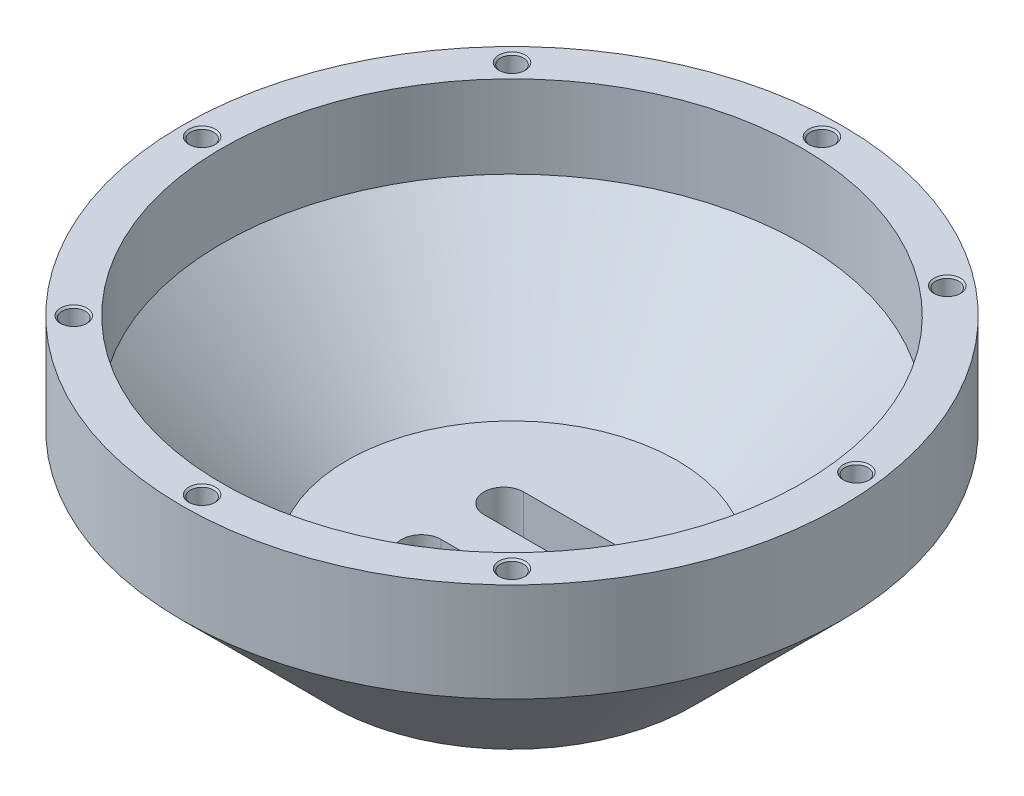
from build123d import *

# Parameters (mm, degrees)
CUT_EXTRUDE1_DEPTH              = 161.078105936
M8X1_0_TAPPED_HOLE2_D           = 7
M8X1_0_TAPPED_HOLE2_DEPTH       = 21
M8X1_0_TAPPED_HOLE2_CSINK_D     = 8.05
M8X1_0_TAPPED_HOLE2_CSINK_ANGLE = 90
M8X1_0_TAPPED_HOLE2_TIP         = 2.103012167


with BuildPart() as part:
    # Sketch2 → Revolve1 (revolve)
    with BuildSketch(Plane.XY, mode=Mode.PRIVATE) as revolve1_sk:
        Polygon((55, 0), (100, 45), (100, 75), (88, 75), (88, 49.970562748), (50.029437252, 12), (0, 12), (0, 0), align=None)
    revolve(revolve1_sk.sketch.rotate(Axis((0, 0, 0), (0, 1, 0)), 90), axis=Axis((0, 0, 0), (0, 1, 0)))

    # Sketch3 → Cut-Extrude1 (cut, through all)
    with BuildSketch(Plane.XZ):
        with BuildLine():
            Line((-15, 18.5), (15, 18.5))
            ThreePointArc((15, 18.5), (21, 12.5), (15, 6.5))
            Line((15, 6.5), (-15, 6.5))
            ThreePointArc((-15, 6.5), (-21, 12.5), (-15, 18.5))
        make_face()
        with BuildLine():
            Line((-15, -6.5), (15, -6.5))
            ThreePointArc((15, -6.5), (21, -12.5), (15, -18.5))
            Line((15, -18.5), (-15, -18.5))
            ThreePointArc((-15, -18.5), (-21, -12.5), (-15, -6.5))
        make_face()
    extrude(amount=-CUT_EXTRUDE1_DEPTH, mode=Mode.SUBTRACT)

    # M8x1.0 Tapped Hole2
    with Locations(Plane(origin=(0, 75, 0), x_dir=(1, 0, 0), z_dir=(0, 1, 0))):
        with Locations((0, 94), (58.139395742, 73.863459591), (93.340114142, 11.118592175), (66.468037432, -66.468037432), (0, -94), (-66.468037432, -66.468037432), (-94, 0), (-66.468037432, 66.468037432)):
            CounterSinkHole(M8X1_0_TAPPED_HOLE2_D / 2, M8X1_0_TAPPED_HOLE2_CSINK_D / 2, depth=M8X1_0_TAPPED_HOLE2_DEPTH, counter_sink_angle=M8X1_0_TAPPED_HOLE2_CSINK_ANGLE)
            with Locations((0, 0, -(M8X1_0_TAPPED_HOLE2_DEPTH + M8X1_0_TAPPED_HOLE2_TIP / 2))):  # 118° drill point
                Cone(0, M8X1_0_TAPPED_HOLE2_D / 2, M8X1_0_TAPPED_HOLE2_TIP, mode=Mode.SUBTRACT)


solid = part.part
